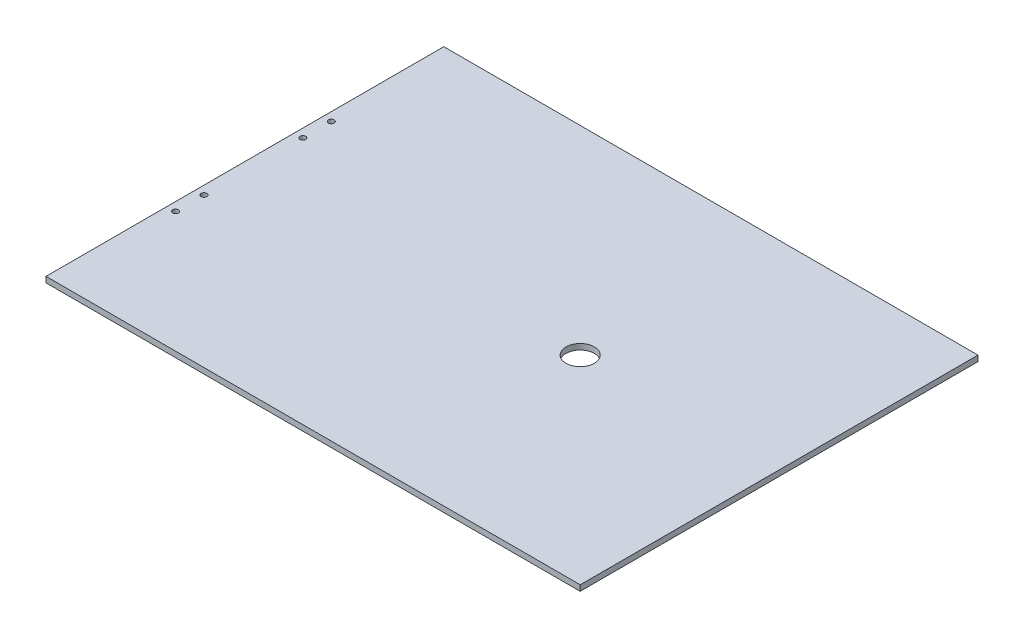
from build123d import *

# Parameters (mm, degrees)
SKETCH6_W           = 350
SKETCH6_H           = 350
SKETCH6_R           = 12.5
BOSS_EXTRUDE1_DEPTH = 5
SKETCH7_W           = 120
SKETCH7_H           = 350
BOSS_EXTRUDE2_DEPTH = 5
SKETCH8_R           = 2.5
CUT_EXTRUDE1_DEPTH  = 10


with BuildPart() as part:
    # Sketch6 → Boss-Extrude1 (new body)
    with BuildSketch(Plane(origin=(0, 0, 0), x_dir=(1, 0, 0), z_dir=(0, 1, 0))):
        Rectangle(SKETCH6_W, SKETCH6_H)
        with Locations(Location((0, 0, 0), (0, 0, 270))):
            Circle(SKETCH6_R, mode=Mode.SUBTRACT)
    extrude(amount=BOSS_EXTRUDE1_DEPTH)

    # Sketch7 → Boss-Extrude2 (add)
    with BuildSketch(Plane(origin=(0, 5, 0), x_dir=(1, 0, 0), z_dir=(0, 1, 0))):
        with Locations((-235, 0)):
            Rectangle(SKETCH7_W, SKETCH7_H)
    extrude(amount=-BOSS_EXTRUDE2_DEPTH)

    # Sketch8 → Cut-Extrude1 (cut)
    with BuildSketch(Plane(origin=(0, 5, 0), x_dir=(1, 0, 0), z_dir=(0, 1, 0))):
        with Locations(Location((-287.5, -43.500000153, 0), (0, 0, 270))):
            Circle(SKETCH8_R)
        with Locations(Location((-287.5, -68.500000153, 0), (0, 0, 270))):
            Circle(SKETCH8_R)
        with Locations(Location((-287.5, 68.500000153, 0), (0, 0, 270))):
            Circle(SKETCH8_R)
        with Locations(Location((-287.5, 43.500000153, 0), (0, 0, 270))):
            Circle(SKETCH8_R)
    extrude(amount=-CUT_EXTRUDE1_DEPTH, mode=Mode.SUBTRACT)


solid = part.part
